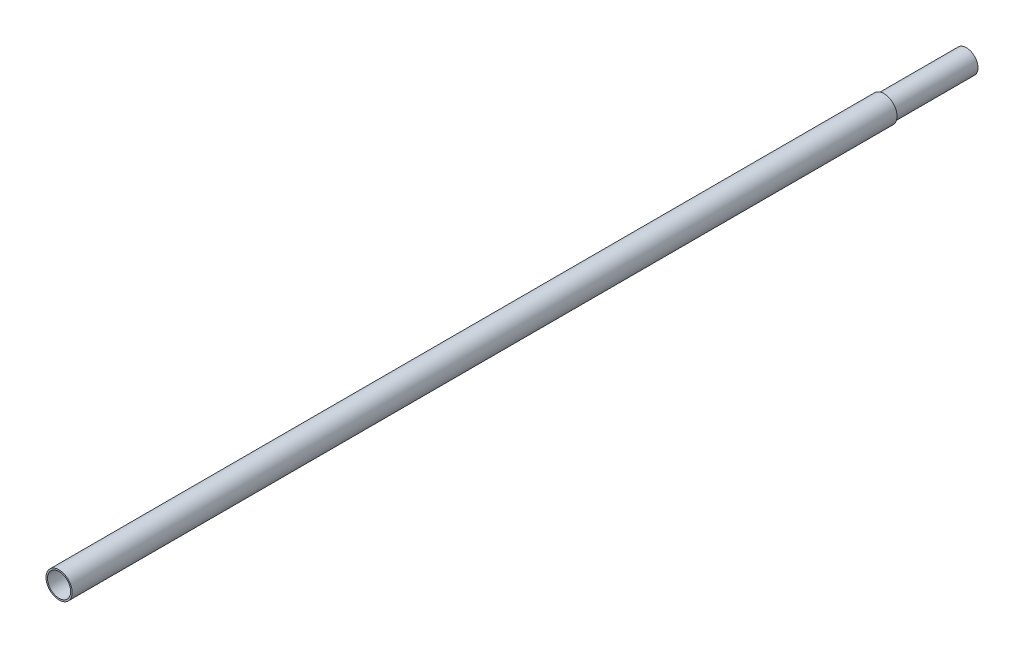
from build123d import *

# Parameters (mm, degrees)
SKETCH1_R           = 11.227
SKETCH1_R_2         = 9.6395
BOSS_EXTRUDE1_DEPTH = 380
BOSS_EXTRUDE2_START = 80
SKETCH2_R           = 12.7
SKETCH2_R_2         = 11.227
BOSS_EXTRUDE2_DEPTH = 800


with BuildPart() as part:
    # Sketch1 → Boss-Extrude1 (new body)
    with BuildSketch(Plane.XY):
        Circle(SKETCH1_R)
        Circle(SKETCH1_R_2, mode=Mode.SUBTRACT)
    extrude(amount=BOSS_EXTRUDE1_DEPTH)

    # Sketch2 → Boss-Extrude2 (add)
    with BuildSketch(Plane.XY.offset(BOSS_EXTRUDE2_START)):
        Circle(SKETCH2_R)
        Circle(SKETCH2_R_2, mode=Mode.SUBTRACT)
    extrude(amount=BOSS_EXTRUDE2_DEPTH)


solid = part.part
